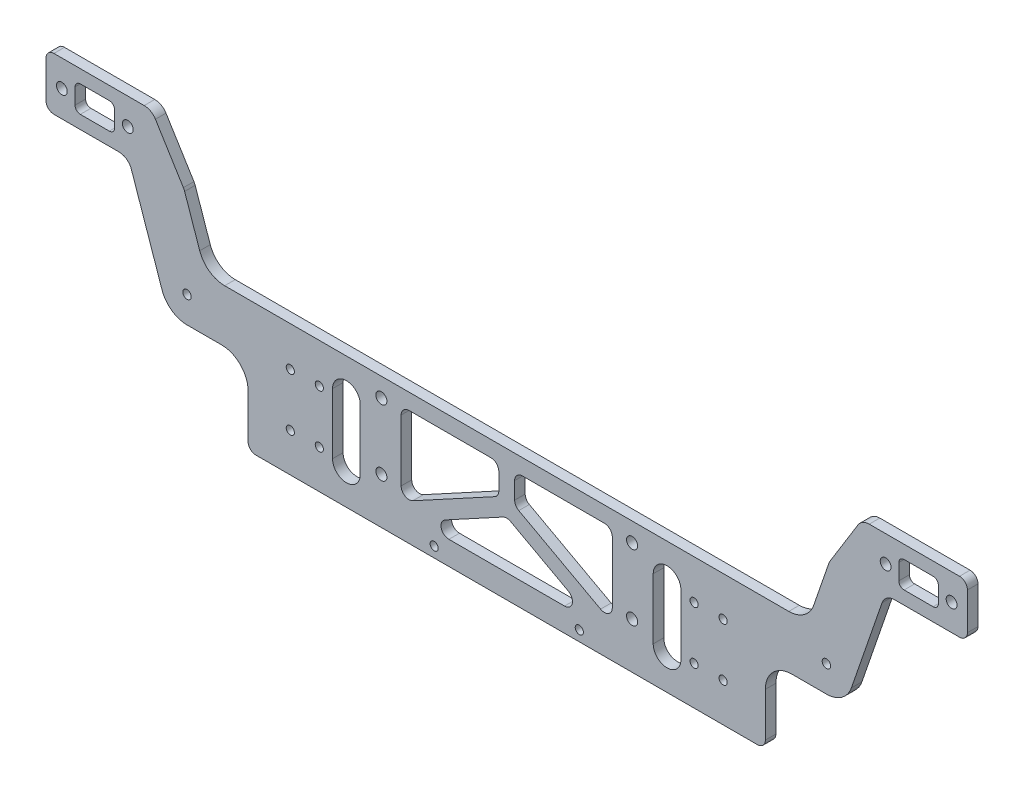
from build123d import *

# Parameters (mm, degrees)
SKETCH_1_W           = 196
SKETCH_1_H           = 49.67
EXTRUDE_1_DEPTH      = 4
EXTRUDE_2_DEPTH      = 4
FILLET_1_R           = 10
FILLET_2_R           = 3
SKETCH_4_R           = 2.1
CUT_EXTRUDE_2_DEPTH  = 4
FILLET_3_R           = 5
SKETCH_5_R           = 1.55
CUT_EXTRUDE_3_DEPTH  = 10
SKETCH_7_R           = 2.05
CUT_EXTRUDE_5_DEPTH  = 102
CUT_EXTRUDE_8_DEPTH  = 10
FILLET_4_R           = 3
SKETCH_15_W          = 6
SKETCH_15_H          = 20
EXTRUDE_4_DEPTH      = 4
FILLET_11_R          = 10
FILLET_12_R          = 2
SKETCH_16_R          = 1.6
CUT_EXTRUDE_13_DEPTH = 10
SKETCH_23_W          = 16
SKETCH_23_H          = 22
CUT_EXTRUDE_17_DEPTH = 10
SKETCH_24_R          = 1.6
EXTRUDE_6_DEPTH      = 4
FILLET_14_R          = 10
SKETCH_25_W          = 15
SKETCH_25_H          = 10
CUT_EXTRUDE_18_DEPTH = 10
SKETCH_27_R          = 1.55
CUT_EXTRUDE_19_DEPTH = 5
SKETCH_30_R          = 1.6
CUT_EXTRUDE_22_DEPTH = 10
FILLET_15_R          = 2
CUT_EXTRUDE_23_DEPTH = 10


with BuildPart() as part:
    # 草图1 → 凸台-拉伸1 (new body)
    with BuildSketch(Plane.XY):
        Rectangle(SKETCH_1_W, SKETCH_1_H)
    extrude(amount=EXTRUDE_1_DEPTH)

    # 草图2 → 凸台-拉伸2 (add)
    with BuildSketch(Plane.XY.offset(4)):
        Polygon((98, 24.835), (114, 24.835), (122.222543405, 48.715), (134.566612912, 68.715), (174.566612912, 68.715), (174.566612912, 48.715), (143.374957029, 48.715), (128.265861358, 4.835), (98, 4.835), align=None)
        Polygon((-98, 24.835), (-98, 4.835), (-128.265861358, 4.835), (-143.374957029, 48.715), (-174.566612912, 48.715), (-174.566612912, 68.715), (-134.566612912, 68.715), (-122.222543405, 48.715), (-114, 24.835), align=None)
    extrude(amount=-EXTRUDE_2_DEPTH)

    # 圆角1
    fillet_1_edges = [part.edges().sort_by_distance(p)[0] for p in [
        (128.265861358, 4.835, 2),
        (114, 24.835, 2),
        (-128.265861358, 4.835, 2),
        (-114, 24.835, 2),
    ]]
    fillet(fillet_1_edges, radius=FILLET_1_R)

    # 圆角2
    fillet_2_edges = [part.edges().sort_by_distance(p)[0] for p in [
        (174.566612912, 48.715, 2),
        (174.566612912, 68.715, 2),
        (-174.566612912, 68.715, 2),
        (-174.566612912, 48.715, 2),
        (98, -24.835, 2),
        (-98, -24.835, 2),
    ]]
    fillet(fillet_2_edges, radius=FILLET_2_R)

    # 草图4 → 切除-拉伸2 (cut)
    with BuildSketch(Plane.XY.offset(4)):
        with Locations((47.5, -7.338706147)):
            Circle(SKETCH_4_R)
        with Locations((47.5, 17.661293853)):
            Circle(SKETCH_4_R)
        with Locations((-47.5, 17.661293853)):
            Circle(SKETCH_4_R)
        with Locations((-47.5, -7.338706147)):
            Circle(SKETCH_4_R)
    extrude(amount=-CUT_EXTRUDE_2_DEPTH, mode=Mode.SUBTRACT)

    # 圆角3
    fillet_3_edges = [part.edges().sort_by_distance(p)[0] for p in [
        (143.374957029, 48.715, 2),
        (134.566612912, 68.715, 2),
        (122.222543405, 48.715, 2),
        (-122.222543405, 48.715, 2),
        (-134.566612912, 68.715, 2),
        (-143.374957029, 48.715, 2),
    ]]
    fillet(fillet_3_edges, radius=FILLET_3_R)

    # 草图5 → 切除-拉伸3 (cut)
    with BuildSketch(Plane.XY.offset(4)):
        with Locations((27.5, -20.895)):
            Circle(SKETCH_5_R)
        with Locations(Location((-27.5, -20.895, 0), (0, 0, 180))):
            Circle(SKETCH_5_R)
    extrude(amount=-CUT_EXTRUDE_3_DEPTH, mode=Mode.SUBTRACT)

    # 草图7 → 切除-拉伸5 (cut)
    with BuildSketch(Plane.XY.offset(4)):
        with Locations((-168.566612912, 58.715)):
            Circle(SKETCH_7_R)
        with Locations((-143.566612912, 58.715)):
            Circle(SKETCH_7_R)
        with Locations(Location((143.566612912, 58.715, 0), (0, 0, 180))):
            Circle(SKETCH_7_R)
        with Locations(Location((168.566612912, 58.715, 0), (0, 0, 180))):
            Circle(SKETCH_7_R)
    extrude(amount=-CUT_EXTRUDE_5_DEPTH, mode=Mode.SUBTRACT)

    # 草图8 → 切除-拉伸8 (cut)
    with BuildSketch(Plane.XY.offset(4)):
        Polygon((-40, 18.835), (-40, -12.480899084), (-3, 7.619350916), (-3, 18.835), align=None)
        Polygon((0, 2.420899084), (-33.715414789, -15.895), (33.715414789, -15.895), align=None)
        Polygon((3, 7.619350916), (40, -12.480899084), (40, 18.835), (3, 18.835), align=None)
    extrude(amount=-CUT_EXTRUDE_8_DEPTH, mode=Mode.SUBTRACT)

    # 圆角4
    fillet_4_edges = [part.edges().sort_by_distance(p)[0] for p in [
        (0, 2.420899084, 2),
        (33.715414789, -15.895, 2),
        (-33.715414789, -15.895, 2),
        (3, 7.619350916, 2),
        (3, 18.835, 2),
        (40, 18.835, 2),
        (40, -12.480899084, 2),
        (-3, 7.619350916, 2),
        (-40, -12.480899084, 2),
        (-40, 18.835, 2),
        (-3, 18.835, 2),
    ]]
    fillet(fillet_4_edges, radius=FILLET_4_R)

    # 草图15 → 凸台-拉伸4 (add)
    with BuildSketch(Plane(origin=(0, 0, 0), x_dir=(-1, 0, 0), z_dir=(0, 0, -1))):
        with Locations((-101, -5.165)):
            Rectangle(SKETCH_15_W, SKETCH_15_H)
    extrude_4 = extrude(amount=-EXTRUDE_4_DEPTH)

    # 镜向5: 凸台-拉伸4 across plane
    add(extrude_4.mirror(Plane(origin=(0, 0, 0), x_dir=(0, 0, 1), z_dir=(1, 0, 0))))

    # 圆角11
    fillet_11_edges = [part.edges().sort_by_distance(p)[0] for p in [
        (104, 4.835, 2),
        (-104, 4.835, 2),
    ]]
    fillet(fillet_11_edges, radius=FILLET_11_R)

    # 圆角12
    fillet_12_edges = [part.edges().sort_by_distance(p)[0] for p in [
        (98, -15.165, 2),
        (104, -15.165, 2),
        (-104, -15.165, 2),
        (-98, -15.165, 2),
    ]]
    fillet(fillet_12_edges, radius=FILLET_12_R)

    # 草图16 → 切除-拉伸13 (cut)
    with BuildSketch(Plane.XY.offset(4)):
        with Locations((104, -10.165)):
            Circle(SKETCH_16_R)
        with Locations((104, 9.835)):
            Circle(SKETCH_16_R)
    cut_extrude_13 = extrude(amount=-CUT_EXTRUDE_13_DEPTH, mode=Mode.SUBTRACT)

    # 镜向6: 切除-拉伸13 across plane
    add(cut_extrude_13.mirror(Plane(origin=(0, 0, 0), x_dir=(0, 0, 1), z_dir=(1, 0, 0))), mode=Mode.SUBTRACT)

    # 草图23 → 切除-拉伸17 (cut)
    with BuildSketch(Plane.XY.offset(4)):
        with Locations((-106, -6.165)):
            Rectangle(SKETCH_23_W, SKETCH_23_H)
        with Locations((106, -6.165)):
            Rectangle(SKETCH_23_W, SKETCH_23_H)
    extrude(amount=-CUT_EXTRUDE_17_DEPTH, mode=Mode.SUBTRACT)

    # 草图24 → 凸台-拉伸6 (add)
    with BuildSketch(Plane.XY.offset(4)):
        with Locations((104, 9.835)):
            Circle(SKETCH_24_R)
        with Locations((-104, 9.835)):
            Circle(SKETCH_24_R)
    extrude(amount=-EXTRUDE_6_DEPTH)

    # 圆角14
    fillet_14_edges = [part.edges().sort_by_distance(p)[0] for p in [
        (-98, 4.835, 2),
        (98, 4.835, 2),
    ]]
    fillet(fillet_14_edges, radius=FILLET_14_R)

    # 草图25 → 切除-拉伸18 (cut)
    with BuildSketch(Plane.XY.offset(4)):
        with Locations((-156.066612912, 58.715)):
            Rectangle(SKETCH_25_W, SKETCH_25_H)
        with Locations((156.066612912, 58.715)):
            Rectangle(SKETCH_25_W, SKETCH_25_H)
    extrude(amount=-CUT_EXTRUDE_18_DEPTH, mode=Mode.SUBTRACT)

    # 草图27 → 切除-拉伸19 (cut)
    with BuildSketch(Plane(origin=(0, 0, 0), x_dir=(-1, 0, 0), z_dir=(0, 0, -1))):
        with Locations((-82, -10.165)):
            Circle(SKETCH_27_R)
        with Locations((-82, 9.835)):
            Circle(SKETCH_27_R)
        with Locations((82, 9.835)):
            Circle(SKETCH_27_R)
        with Locations((82, -10.165)):
            Circle(SKETCH_27_R)
        with Locations((-71, 9.835)):
            Circle(SKETCH_27_R)
        with Locations((-71, -10.165)):
            Circle(SKETCH_27_R)
        with Locations((71, -10.165)):
            Circle(SKETCH_27_R)
        with Locations((71, 9.835)):
            Circle(SKETCH_27_R)
    extrude(amount=-CUT_EXTRUDE_19_DEPTH, mode=Mode.SUBTRACT)

    # 草图30 → 切除-拉伸22 (cut)
    with BuildSketch(Plane.XY.offset(4)):
        with Locations((121.132930679, 14.835)):
            Circle(SKETCH_30_R)
        with Locations(Location((-121.132930679, 14.835, 0), (0, 0, 180))):
            Circle(SKETCH_30_R)
    extrude(amount=-CUT_EXTRUDE_22_DEPTH, mode=Mode.SUBTRACT)

    # 圆角15
    fillet_15_edges = [part.edges().sort_by_distance(p)[0] for p in [
        (-148.566612912, 63.715, 2),
        (-148.566612912, 53.715, 2),
        (-163.566612912, 53.715, 2),
        (-163.566612912, 63.715, 2),
        (163.566612912, 63.715, 2),
        (163.566612912, 53.715, 2),
        (148.566612912, 53.715, 2),
        (148.566612912, 63.715, 2),
    ]]
    fillet(fillet_15_edges, radius=FILLET_15_R)

    # 草图31 → 切除-拉伸23 (cut)
    with BuildSketch(Plane.XY.offset(4)):
        with BuildLine():
            Line((66, 11.5), (66, -11.5))
            ThreePointArc((66, -11.5), (60.75, -16.75), (55.5, -11.5))
            Line((55.5, -11.5), (55.5, 11.5))
            ThreePointArc((55.5, 11.5), (60.75, 16.75), (66, 11.5))
        make_face()
        with BuildLine():
            Line((-66, 11.5), (-66, -11.5))
            ThreePointArc((-66, -11.5), (-60.75, -16.75), (-55.5, -11.5))
            Line((-55.5, -11.5), (-55.5, 11.5))
            ThreePointArc((-55.5, 11.5), (-60.75, 16.75), (-66, 11.5))
        make_face()
    extrude(amount=-CUT_EXTRUDE_23_DEPTH, mode=Mode.SUBTRACT)


solid = part.part
